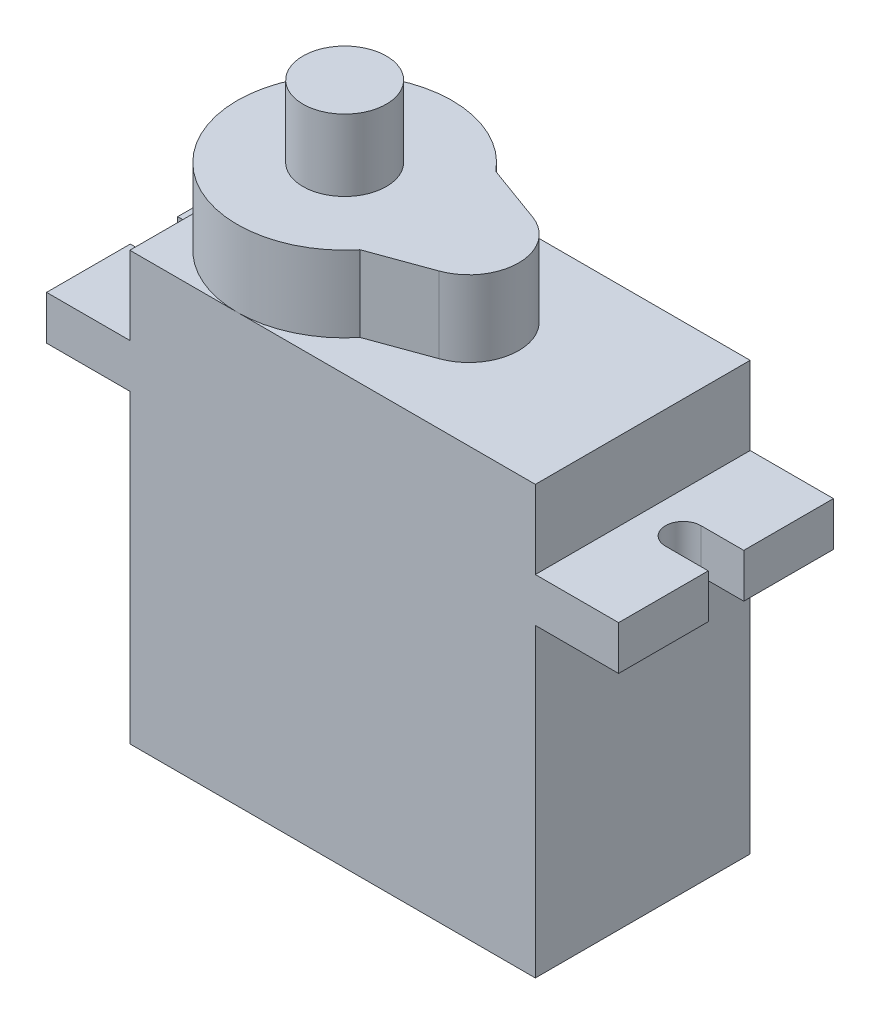
from build123d import *

# Parameters (mm, degrees)
SKETCH1_W           = 22.84
SKETCH1_H           = 12.1
BOSS_EXTRUDE1_DEPTH = 17.2
BOSS_EXTRUDE2_DEPTH = 2.48
BOSS_EXTRUDE3_START = 2.48
SKETCH1_4_W         = 22.84
SKETCH1_4_H         = 12.1
BOSS_EXTRUDE3_DEPTH = 4.4
BOSS_EXTRUDE4_START = 6.88
SKETCH1_5_R         = 2.8
SKETCH1_5_R_2       = 6.05
SKETCH1_5_R_3       = 2.35
BOSS_EXTRUDE4_DEPTH = 4.28
BOSS_EXTRUDE5_START = 11.16
SKETCH1_6_R         = 2.35
BOSS_EXTRUDE5_DEPTH = 4.02


with BuildPart() as part:
    # Sketch1 → Boss-Extrude1 (new body)
    with BuildSketch(Plane(origin=(0, 0, 0), x_dir=(1, 0, 0), z_dir=(0, 1, 0))):
        with Locations((5.37, 0)):
            Rectangle(SKETCH1_W, SKETCH1_H)
    extrude(amount=-BOSS_EXTRUDE1_DEPTH)

    # Sketch1<3> → Boss-Extrude2 (add)
    with BuildSketch(Plane(origin=(0, 0, 0), x_dir=(1, 0, 0), z_dir=(0, 1, 0))):
        with BuildLine():
            Line((21.48, -6.05), (21.48, -1))
            Line((21.48, -1), (19.07, -1))
            ThreePointArc((19.07, -1), (18.07, 0), (19.07, 1))
            Line((19.07, 1), (21.48, 1))
            Line((21.48, 1), (21.48, 6.05))
            Line((21.48, 6.05), (-10.74, 6.05))
            Line((-10.74, 6.05), (-10.74, 1.33332999))
            Line((-10.74, 1.33332999), (-8.33, 1.33332999))
            ThreePointArc((-8.33, 1.33332999), (-6.99667001, 0), (-8.33, -1.33332999))
            Line((-8.33, -1.33332999), (-10.74, -1.33332999))
            Line((-10.74, -1.33332999), (-10.74, -6.05))
            Line((-10.74, -6.05), (21.48, -6.05))
        make_face()
    extrude(amount=BOSS_EXTRUDE2_DEPTH)

    # Sketch1<4> → Boss-Extrude3 (add)
    with BuildSketch(Plane(origin=(0, 0, 0), x_dir=(1, 0, 0), z_dir=(0, 1, 0)).offset(BOSS_EXTRUDE3_START)):
        with Locations((5.37, 0)):
            Rectangle(SKETCH1_4_W, SKETCH1_4_H)
    extrude(amount=BOSS_EXTRUDE3_DEPTH)

    # Sketch1<5> → Boss-Extrude4 (add)
    # profile 1 of 9: a face of its own
    with BuildSketch(Plane(origin=(0, 0, 0), x_dir=(1, 0, 0), z_dir=(0, 1, 0)).offset(BOSS_EXTRUDE4_START)):
        with Locations((7, 0)):
            Circle(SKETCH1_5_R)
    # profile 2 of 9: a face of its own
    with BuildSketch(Plane(origin=(0, 0, 0), x_dir=(1, 0, 0), z_dir=(0, 1, 0)).offset(BOSS_EXTRUDE4_START)):
        Circle(SKETCH1_5_R_2)
        Circle(SKETCH1_5_R_3, mode=Mode.SUBTRACT)
    # profile 3 of 9: a face of its own
    with BuildSketch(Plane(origin=(0, 0, 0), x_dir=(1, 0, 0), z_dir=(0, 1, 0)).offset(BOSS_EXTRUDE4_START)):
        with BuildLine():
            Line((4.691578101, -3.819894622), (7.957656401, -2.631139338))
            ThreePointArc((7.957656401, -2.631139338), (6.72964006, -2.786916845), (5.554464286, -2.398004691))
            ThreePointArc((5.554464286, -2.398004691), (5.172116481, -3.138743556), (4.691578101, -3.819894622))
        make_face()
    # profile 4 of 9: a face of its own
    with BuildSketch(Plane(origin=(0, 0, 0), x_dir=(1, 0, 0), z_dir=(0, 1, 0)).offset(BOSS_EXTRUDE4_START)):
        with BuildLine():
            ThreePointArc((5.554464286, 2.398004691), (6.72964006, 2.786916845), (7.957656401, 2.631139338))
            Line((7.957656401, 2.631139338), (4.691578101, 3.819894622))
            ThreePointArc((4.691578101, 3.819894622), (5.172116481, 3.138743556), (5.554464286, 2.398004691))
        make_face()
    # profile 5 of 9: a face of its own
    with BuildSketch(Plane(origin=(0, 0, 0), x_dir=(1, 0, 0), z_dir=(0, 1, 0)).offset(BOSS_EXTRUDE4_START)):
        Circle(SKETCH1_5_R_2)
    # profile 6 of 9: a face of its own
    with BuildSketch(Plane(origin=(0, 0, 0), x_dir=(1, 0, 0), z_dir=(0, 1, 0)).offset(BOSS_EXTRUDE4_START)):
        with Locations((7, 0)):
            Circle(SKETCH1_5_R)
    # profile 7 of 9: a face of its own
    with BuildSketch(Plane(origin=(0, 0, 0), x_dir=(1, 0, 0), z_dir=(0, 1, 0)).offset(BOSS_EXTRUDE4_START)):
        with Locations((7, 0)):
            Circle(SKETCH1_5_R)
    # profile 8 of 9: a face of its own
    with BuildSketch(Plane(origin=(0, 0, 0), x_dir=(1, 0, 0), z_dir=(0, 1, 0)).offset(BOSS_EXTRUDE4_START)):
        Circle(SKETCH1_5_R_2)
    # profile 9 of 9: a face of its own
    with BuildSketch(Plane(origin=(0, 0, 0), x_dir=(1, 0, 0), z_dir=(0, 1, 0)).offset(BOSS_EXTRUDE4_START)):
        Circle(SKETCH1_5_R_3)
    extrude(amount=BOSS_EXTRUDE4_DEPTH)

    # Sketch1<6> → Boss-Extrude5 (add)
    with BuildSketch(Plane(origin=(0, 0, 0), x_dir=(1, 0, 0), z_dir=(0, 1, 0)).offset(BOSS_EXTRUDE5_START)):
        with Locations(Location((0, 0, 0), (0, 0, 270))):
            Circle(SKETCH1_6_R)
    extrude(amount=BOSS_EXTRUDE5_DEPTH)


solid = part.part
